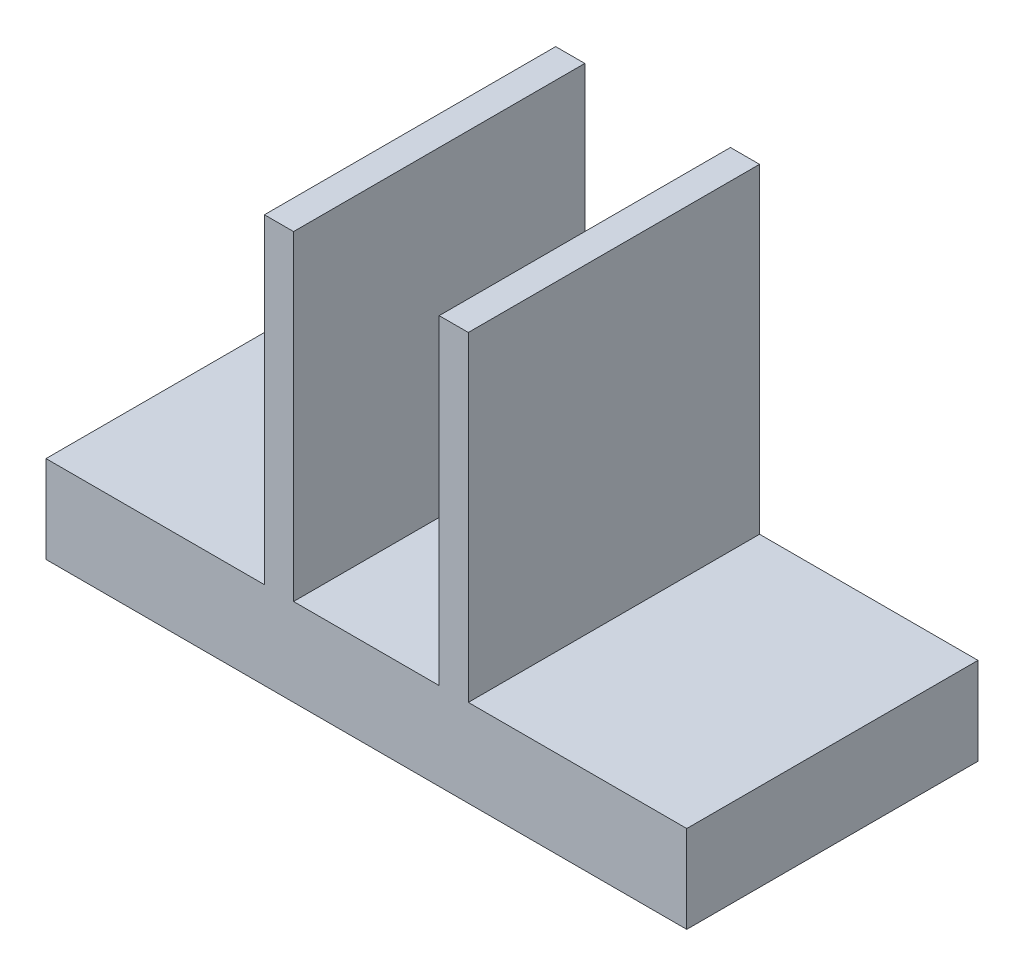
from build123d import *

# Parameters (mm, degrees)
EXTRUDE_1_DEPTH = 10


with BuildPart() as part:
    # Эскиз1 → Бобышка-Вытянуть1 (new body)
    with BuildSketch(Plane.XY):
        Polygon((0, 0), (22, 0), (22, 3), (14.5, 3), (14.5, 14), (13.5, 14), (13.5, 3), (8.5, 3), (8.5, 14), (7.5, 14), (7.5, 3), (0, 3), align=None)
    extrude(amount=EXTRUDE_1_DEPTH)


solid = part.part
